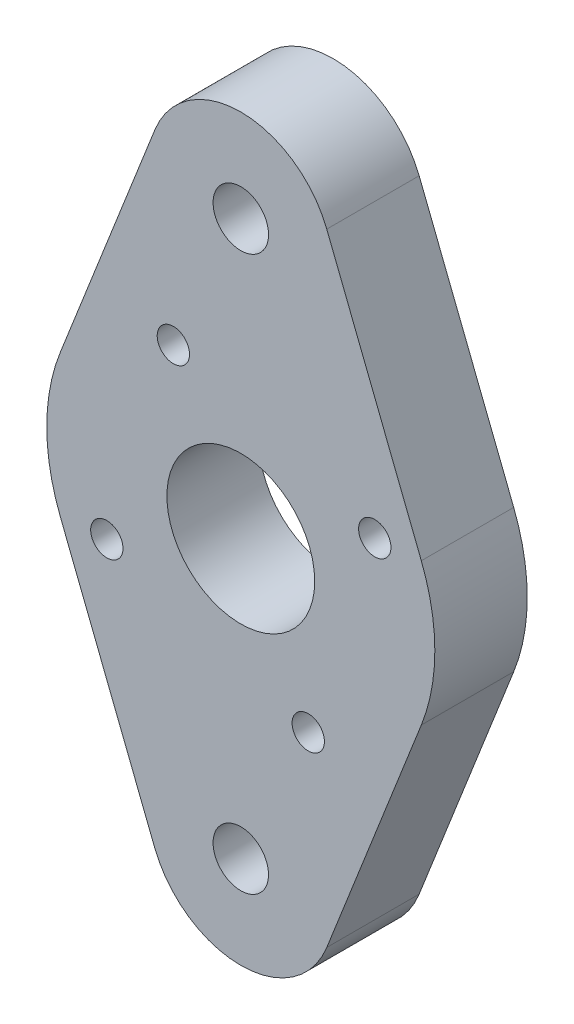
from build123d import *

# Parameters (mm, degrees)
ESQUISSE1_R        = 4
ESQUISSE1_R_2      = 0.875
ESQUISSE1_R_3      = 1.5
BOSS_EXTRU_1_DEPTH = 5


with BuildPart() as part:
    # Esquisse1 → Boss.-Extru.1 (new body)
    with BuildSketch(Plane.XY):
        with BuildLine():
            Line((-9.768700016, 3.85), (-4.651761912, 16.833333333))
            ThreePointArc((-4.651761912, 16.833333333), (0, 20), (4.651761912, 16.833333333))
            Line((4.651761912, 16.833333333), (9.768700016, 3.85))
            ThreePointArc((9.768700016, 3.85), (10.5, 0), (9.768700016, -3.85))
            Line((9.768700016, -3.85), (4.651761912, -16.833333333))
            ThreePointArc((4.651761912, -16.833333333), (0, -20), (-4.651761912, -16.833333333))
            Line((-4.651761912, -16.833333333), (-9.768700016, -3.85))
            ThreePointArc((-9.768700016, -3.85), (-10.5, 0), (-9.768700016, 3.85))
        make_face()
        Circle(ESQUISSE1_R, mode=Mode.SUBTRACT)
        with Locations((7.25, 3.65)):
            Circle(ESQUISSE1_R_2, mode=Mode.SUBTRACT)
        with Locations((3.65, -7.25)):
            Circle(ESQUISSE1_R_2, mode=Mode.SUBTRACT)
        with Locations((-7.25, -3.65)):
            Circle(ESQUISSE1_R_2, mode=Mode.SUBTRACT)
        with Locations((-3.65, 7.25)):
            Circle(ESQUISSE1_R_2, mode=Mode.SUBTRACT)
        with Locations((0, 15)):
            Circle(ESQUISSE1_R_3, mode=Mode.SUBTRACT)
        with Locations(Location((0, -15, 0), (0, 0, 180))):
            Circle(ESQUISSE1_R_3, mode=Mode.SUBTRACT)
    extrude(amount=BOSS_EXTRU_1_DEPTH)


solid = part.part
